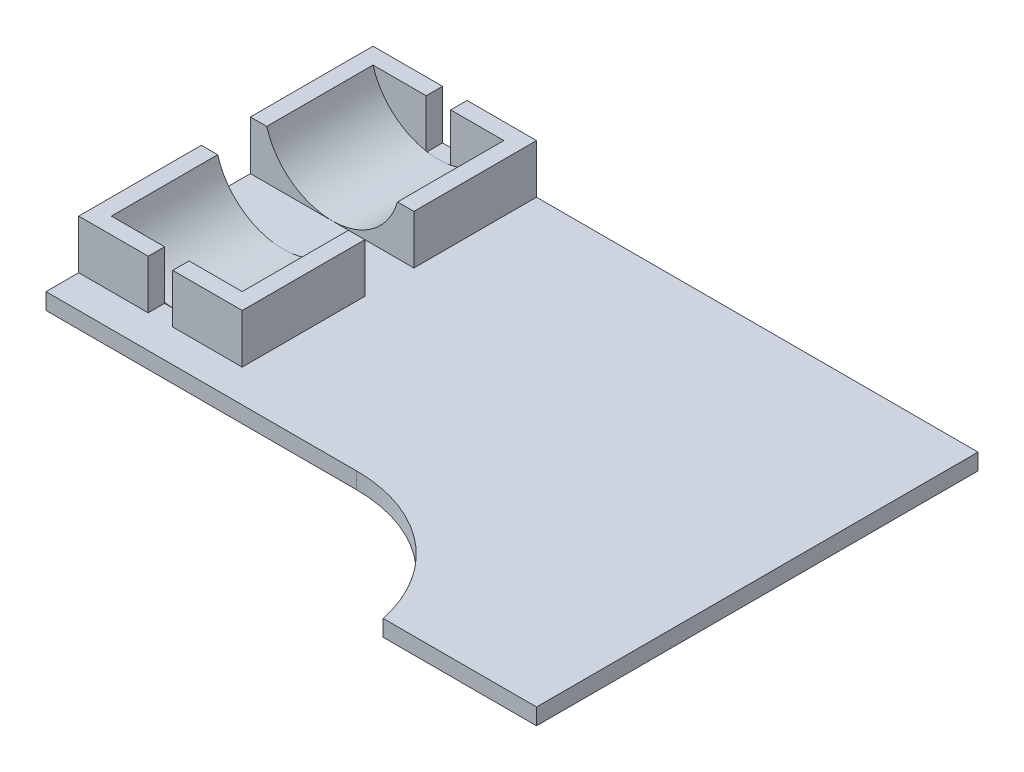
from build123d import *

# Parameters (mm, degrees)
BOSS_EXTRUDE1_DEPTH     = 10
BOSS_EXTRUDE2_DEPTH     = 30
BOSS_EXTRUDE3_REACH     = 323.598
CUT_EXTRUDE1_DEPTH      = 396.885084336
CUT_EXTRUDE1_DEPTH_BACK = 396.885084336
SKETCH5_W               = 30
SKETCH5_H               = 30


with BuildPart() as part:
    # Sketch1 → Boss-Extrude1 (new body)
    with BuildSketch(Plane(origin=(0, 0, 0), x_dir=(1, 0, 0), z_dir=(0, 1, 0))):
        with BuildLine():
            Line((-185, -65), (5, -65))
            ThreePointArc((5, -65), (60.514401442, -84.704810384), (91.182336182, -135))
            Line((91.182336182, -135), (185, -135))
            Line((185, -135), (185, 135))
            Line((185, 135), (-185, 135))
            Line((-185, 135), (-185, -65))
        make_face()
    extrude(amount=BOSS_EXTRUDE1_DEPTH)

    # Sketch2 → Boss-Extrude2 (add)
    with BuildSketch(Plane(origin=(0, 10, 0), x_dir=(1, 0, 0), z_dir=(0, 1, 0))):
        Polygon((-175, -35), (-175, 30), (-185, 30), (-185, -45), (-142.5, -45), (-142.5, -35), align=None)
        Polygon((-175, 125), (-142.5, 125), (-142.5, 135), (-185, 135), (-185, 60), (-175, 60), align=None)
        Polygon((-95, -35), (-95, 30), (-85, 30), (-85, -45), (-127.5, -45), (-127.5, -35), align=None)
        Polygon((-127.5, 135), (-127.5, 125), (-95, 125), (-95, 60), (-85, 60), (-85, 135), align=None)
    extrude(amount=BOSS_EXTRUDE2_DEPTH)

    # Boss-Extrude3: up to this face of the body (flat: up to its plane)
    boss_extrude3_end = Plane(part.part.faces().sort_by_distance((-158.75, 25, 35))[0])
    # Sketch3 → Boss-Extrude3 (add, up to the picked face)
    with BuildSketch(Plane.XY.offset(-125), mode=Mode.PRIVATE) as boss_extrude3_sk1:
        with BuildLine():
            ThreePointArc((-134.999999946, 10), (-159.999999978, 18.333333317), (-175, 40))
            Line((-175, 40), (-175, 10))
            Line((-175, 10), (-134.999999946, 10))
        make_face()
    boss_extrude3_tool1 = split(extrude(boss_extrude3_sk1.sketch, amount=BOSS_EXTRUDE3_REACH, mode=Mode.PRIVATE), bisect_by=boss_extrude3_end, keep=Keep.BOTH, mode=Mode.PRIVATE)
    # Sketch3 → Boss-Extrude3 (add, up to the picked face)
    with BuildSketch(Plane.XY.offset(-125), mode=Mode.PRIVATE) as boss_extrude3_sk2:
        with BuildLine():
            Line((-134.999999946, 10), (-95, 10))
            Line((-95, 10), (-95, 40))
            ThreePointArc((-95, 40), (-109.999999978, 18.33333335), (-134.999999946, 10))
        make_face()
    boss_extrude3_tool2 = split(extrude(boss_extrude3_sk2.sketch, amount=BOSS_EXTRUDE3_REACH, mode=Mode.PRIVATE), bisect_by=boss_extrude3_end, keep=Keep.BOTH, mode=Mode.PRIVATE)
    add(boss_extrude3_tool1.solids().sort_by(Axis((-165.840385, 17.926758, -125), (0, 0, 1)))[0])
    add(boss_extrude3_tool2.solids().sort_by(Axis((-104.159615, 17.926758, -125), (0, 0, 1)))[0])

    # Sketch5 → Cut-Extrude1 (cut, two sides: drawn at the far end of the back side and taken through both)
    with BuildSketch(Plane.ZY.offset(185).offset(-CUT_EXTRUDE1_DEPTH_BACK)):
        with Locations((-45, 25)):
            Rectangle(SKETCH5_W, SKETCH5_H)
    extrude(amount=CUT_EXTRUDE1_DEPTH + CUT_EXTRUDE1_DEPTH_BACK, mode=Mode.SUBTRACT)


solid = part.part
